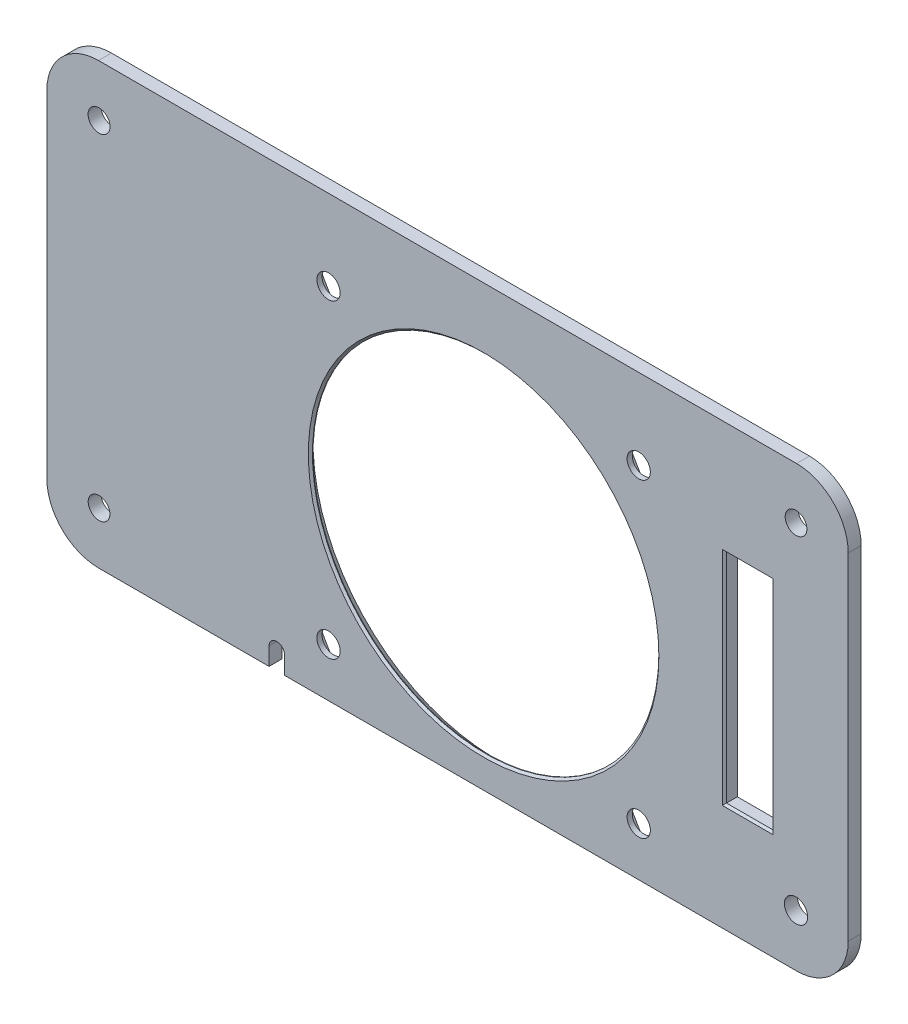
from build123d import *

# Parameters (mm, degrees)
BOSS_EXTRUDE1_DEPTH = 2.5
SKETCH3_R           = 2.25
SKETCH3_R_2         = 2.1
SKETCH3_R_3         = 2.121320344
CUT_EXTRUDE1_DEPTH  = 3
SKETCH4_R           = 33.5
SKETCH4_R_2         = 2.25
CUT_EXTRUDE2_DEPTH  = 5
CUT_EXTRUDE3_DEPTH  = 1.5
CHAMFER1_SIZE       = 2
CUT_EXTRUDE4_DEPTH  = 3
SKETCH7_R           = 2.25
SKETCH7_R_2         = 1.25
BOSS_EXTRUDE2_DEPTH = 3
CHAMFER2_SIZE       = 2
SKETCH12_W          = 9
SKETCH12_H          = 42.1
CUT_EXTRUDE5_DEPTH  = 7
CHAMFER3_SIZE       = 0.4


with BuildPart() as part:
    # Sketch1 → Boss-Extrude1 (new body)
    with BuildSketch(Plane.XY):
        with BuildLine():
            Line((-15.633211847, 85.984955899), (119.366788153, 85.984955899))
            ThreePointArc((119.366788153, 85.984955899), (126.437855965, 83.05602371), (129.366788153, 75.984955899))
            Line((129.366788153, 75.984955899), (129.366788153, 10.984955899))
            ThreePointArc((129.366788153, 10.984955899), (126.437855965, 3.913888087), (119.366788153, 0.984955899))
            Line((119.366788153, 0.984955899), (-15.633211847, 0.984955899))
            ThreePointArc((-15.633211847, 0.984955899), (-22.704279659, 3.913888087), (-25.633211847, 10.984955899))
            Line((-25.633211847, 10.984955899), (-25.633211847, 75.984955899))
            ThreePointArc((-25.633211847, 75.984955899), (-22.704279659, 83.05602371), (-15.633211847, 85.984955899))
        make_face()
    extrude(amount=BOSS_EXTRUDE1_DEPTH)

    # Sketch3 → Cut-Extrude1 (cut)
    with BuildSketch(Plane.XY.offset(2.5)):
        with Locations((119.266788153, 11.084955899)):
            Circle(SKETCH3_R)
        with Locations((119.266788153, 75.984955899)):
            Circle(SKETCH3_R_2)
        with Locations((-15.533211847, 75.984955899)):
            Circle(SKETCH3_R_3)
        with Locations((-15.533211847, 11.084955899)):
            Circle(SKETCH3_R_2)
    extrude(amount=-CUT_EXTRUDE1_DEPTH, mode=Mode.SUBTRACT)

    # Sketch4 → Cut-Extrude2 (cut)
    with BuildSketch(Plane.XY.offset(2.5)):
        with Locations((58.842502754, 40.410046739)):
            Circle(SKETCH4_R)
        with Locations((28.842502754, 70.410046739)):
            Circle(SKETCH4_R_2)
        with Locations((88.842502754, 70.410046739)):
            Circle(SKETCH4_R_2)
        with Locations((88.842502754, 10.410046739)):
            Circle(SKETCH4_R_2)
        with Locations((28.842502754, 10.410046739)):
            Circle(SKETCH4_R_2)
    extrude(amount=-CUT_EXTRUDE2_DEPTH, mode=Mode.SUBTRACT)

    # Sketch5 → Cut-Extrude3 (cut)
    with BuildSketch(Plane(origin=(0, 0, 0), x_dir=(-1, 0, 0), z_dir=(0, 0, -1))):
        Polygon((-93.172629773, 10.410046739), (-91.007566263, 6.660046739), (-86.677439244, 6.660046739), (-84.512375735, 10.410046739), (-86.677439244, 14.160046739), (-91.007566263, 14.160046739), align=None)
        Polygon((-33.172629773, 10.410046739), (-31.007566263, 6.660046739), (-26.677439244, 6.660046739), (-24.512375735, 10.410046739), (-26.677439244, 14.160046739), (-31.007566263, 14.160046739), align=None)
        Polygon((-93.172629773, 70.410046739), (-91.007566263, 66.660046739), (-86.677439244, 66.660046739), (-84.512375735, 70.410046739), (-86.677439244, 74.160046739), (-91.007566263, 74.160046739), align=None)
        Polygon((-33.172629773, 70.410046739), (-31.007566263, 66.660046739), (-26.677439244, 66.660046739), (-24.512375735, 70.410046739), (-26.677439244, 74.160046739), (-31.007566263, 74.160046739), align=None)
    extrude(amount=-CUT_EXTRUDE3_DEPTH, mode=Mode.SUBTRACT)

    # Chamfer1
    chamfer1_edges = [part.edges().sort_by_distance(p)[0] for p in [
        (25.342502754, 40.410046739, 0),
    ]]
    chamfer(chamfer1_edges, length=CHAMFER1_SIZE)

    # Sketch6 → Cut-Extrude4 (cut)
    with BuildSketch(Plane.XY.offset(2.5)):
        with BuildLine():
            Line((20.342502754, 4.410046739), (20.342502754, 0.984955899))
            ThreePointArc((20.342502754, 0.984955899), (18.842502754, -0.515044101), (17.342502754, 0.984955899))
            Line((17.342502754, 0.984955899), (17.342502754, 4.410046739))
            ThreePointArc((17.342502754, 4.410046739), (18.842502754, 5.910046739), (20.342502754, 4.410046739))
        make_face()
    extrude(amount=-CUT_EXTRUDE4_DEPTH, mode=Mode.SUBTRACT)

    # Sketch7 → Boss-Extrude2 (add)
    # profile 1 of 2: a face of its own
    with BuildSketch(Plane(origin=(0, 0, 0), x_dir=(-1, 0, 0), z_dir=(0, 0, -1))):
        with Locations(Location((18.233971147, 25.069955899, 0), (0, 0, 180))):
            Circle(SKETCH7_R)
        with Locations((18.233971147, 25.069955899)):
            Circle(SKETCH7_R_2, mode=Mode.SUBTRACT)
    # profile 2 of 2: a face of its own
    with BuildSketch(Plane(origin=(0, 0, 0), x_dir=(-1, 0, 0), z_dir=(0, 0, -1))):
        with Locations(Location((1.723971147, 25.069955899, 0), (0, 0, 180))):
            Circle(SKETCH7_R)
        with Locations((1.723971147, 25.069955899)):
            Circle(SKETCH7_R_2, mode=Mode.SUBTRACT)
    extrude(amount=BOSS_EXTRUDE2_DEPTH)

    # Chamfer2
    chamfer2_edges = [part.edges().sort_by_distance(p)[0] for p in [
        (-20.483971147, 25.069955899, 0),
        (-3.973971147, 25.069955899, 0),
    ]]
    chamfer(chamfer2_edges, length=CHAMFER2_SIZE)

    # Sketch12 → Cut-Extrude5 (cut)
    with BuildSketch(Plane.XY.offset(2.5)):
        with Locations((109.912689541, 42.984621363)):
            Rectangle(SKETCH12_W, SKETCH12_H)
    extrude(amount=-CUT_EXTRUDE5_DEPTH, mode=Mode.SUBTRACT)

    # Chamfer3
    chamfer3_edges = [part.edges().sort_by_distance(p)[0] for p in [
        (105.412689541, 42.984621363, 2.5),
        (109.912689541, 21.934621363, 2.5),
        (114.412689541, 42.984621363, 2.5),
        (109.912689541, 64.034621363, 2.5),
        (25.342502754, 40.410046739, 2.5),
    ]]
    chamfer(chamfer3_edges, length=CHAMFER3_SIZE)


solid = part.part
